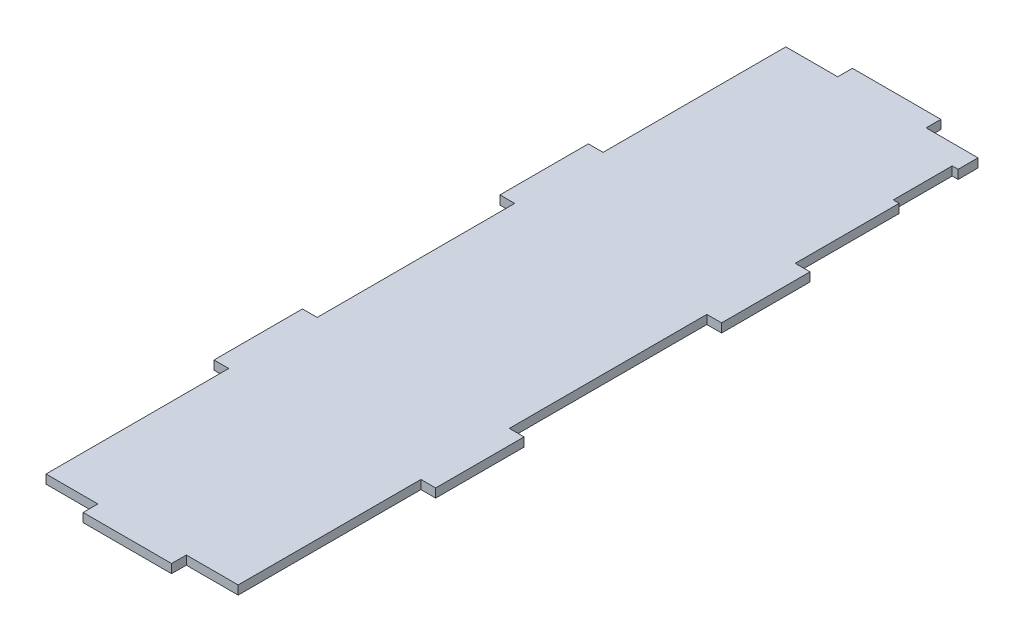
from build123d import *

# Parameters (mm, degrees)
SKETCH1_W           = 75.2
SKETCH1_H           = 261
BOSS_EXTRUDE1_DEPTH = 3
SKETCH2_W           = 5
SKETCH2_H           = 67
CUT_EXTRUDE1_DEPTH  = 136.841856583
SKETCH3_W           = 2
SKETCH3_H           = 20
CUT_EXTRUDE2_DEPTH  = 136.841856583


with BuildPart() as part:
    # Sketch1 → Boss-Extrude1 (new body)
    with BuildSketch(Plane(origin=(0, 0, 0), x_dir=(1, 0, 0), z_dir=(0, 1, 0))):
        Rectangle(SKETCH1_W, SKETCH1_H)
    extrude(amount=BOSS_EXTRUDE1_DEPTH)

    # Sketch2 → Cut-Extrude1 (cut, through all)
    with BuildSketch(Plane(origin=(0, 3, 0), x_dir=(1, 0, 0), z_dir=(0, 1, 0))):
        Polygon((-37.6, -130.5), (-15, -130.5), (-15, -125.5), (-32.6, -125.5), (-32.6, -63.5), (-37.6, -63.5), align=None)
        with Locations((-35.1, 0)):
            Rectangle(SKETCH2_W, SKETCH2_H)
        Polygon((-37.6, 130.5), (-15, 130.5), (-15, 125.5), (-32.6, 125.5), (-32.6, 63.5), (-37.6, 63.5), align=None)
    cut_extrude1 = extrude(amount=-CUT_EXTRUDE1_DEPTH, mode=Mode.SUBTRACT)

    # Mirror1: Cut-Extrude1 across plane
    add(cut_extrude1.mirror(Plane(origin=(0, 0, 0), x_dir=(0, 0, 1), z_dir=(1, 0, 0))), mode=Mode.SUBTRACT)

    # Sketch3 → Cut-Extrude2 (cut, through all)
    with BuildSketch(Plane(origin=(0, 3, 0), x_dir=(1, 0, 0), z_dir=(0, 1, 0))):
        with Locations((31.6, 108.75)):
            Rectangle(SKETCH3_W, SKETCH3_H)
    extrude(amount=-CUT_EXTRUDE2_DEPTH, mode=Mode.SUBTRACT)


solid = part.part
